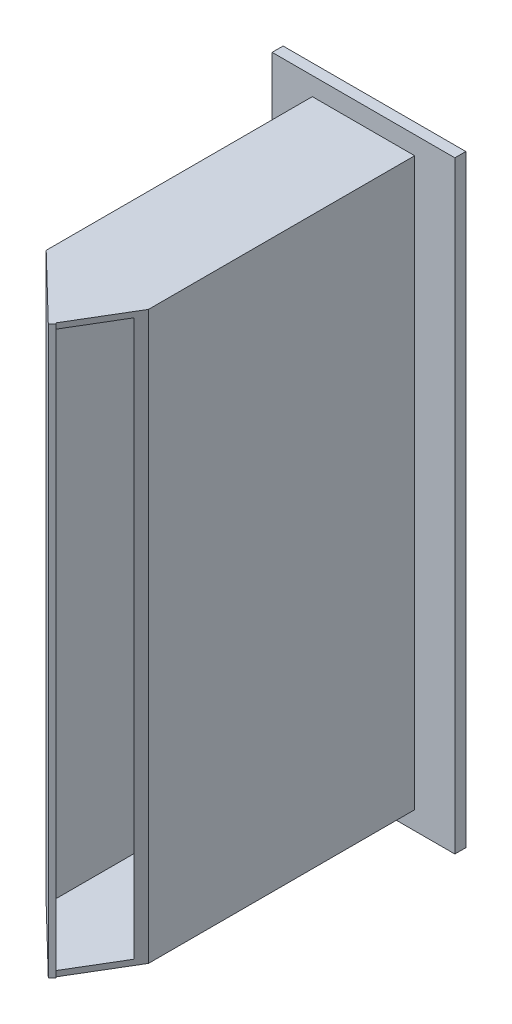
from build123d import *

# Parameters (mm, degrees)
SKETCH_1_W          = 10
SKETCH_1_H          = 33
SKETCH_1_W_2        = 5
SKETCH_1_H_2        = 30.4
EXTRUDE_1_DEPTH     = 0.6
SKETCH_2_W          = 5.6
SKETCH_2_H          = 31
SKETCH_2_W_2        = 5
SKETCH_2_H_2        = 30.4
EXTRUDE_2_DEPTH     = 18
CUT_EXTRUDE_1_DEPTH = 39.340057381
SKETCH_6_W          = 4.938455529
SKETCH_6_H          = 31
EXTRUDE_5_DEPTH     = 0.3


with BuildPart() as part:
    # 草图1 → 凸台-拉伸1 (new body)
    with BuildSketch(Plane.XY):
        with Locations((5, 16.5)):
            Rectangle(SKETCH_1_W, SKETCH_1_H)
        with Locations((5, 16.5)):
            Rectangle(SKETCH_1_W_2, SKETCH_1_H_2, mode=Mode.SUBTRACT)
    extrude(amount=EXTRUDE_1_DEPTH)

    # 草图2 → 凸台-拉伸2 (add)
    with BuildSketch(Plane.XY.offset(0.6)):
        with Locations((5, 16.5)):
            Rectangle(SKETCH_2_W, SKETCH_2_H)
        with Locations((5, 16.5)):
            Rectangle(SKETCH_2_W_2, SKETCH_2_H_2, mode=Mode.SUBTRACT)
    extrude(amount=EXTRUDE_2_DEPTH)

    # 草图5 → 切除-拉伸1 (cut, through all)
    with BuildSketch(Plane(origin=(0, 32, 0), x_dir=(1, 0, 0), z_dir=(0, 1, 0))):
        Polygon((2.2, -15.165872509), (5.748959197, -18.6), (7.8, -15.165872509), (7.8, -19.376577353), (2.2, -19.376577353), align=None)
    extrude(amount=-CUT_EXTRUDE_1_DEPTH, mode=Mode.SUBTRACT)

    # 草图6 → 凸台-拉伸5 (add)
    with BuildSketch(Plane(origin=(-6.515003899, 0, 6.732855162), x_dir=(0.7186374720968006, 0, 0.6953849176523174), z_dir=(-0.6953849176523174, 0, 0.7186374720968006))):
        with Locations((14.596349209, 16.5)):
            Rectangle(SKETCH_6_W, SKETCH_6_H)
    extrude(amount=-EXTRUDE_5_DEPTH)


solid = part.part
